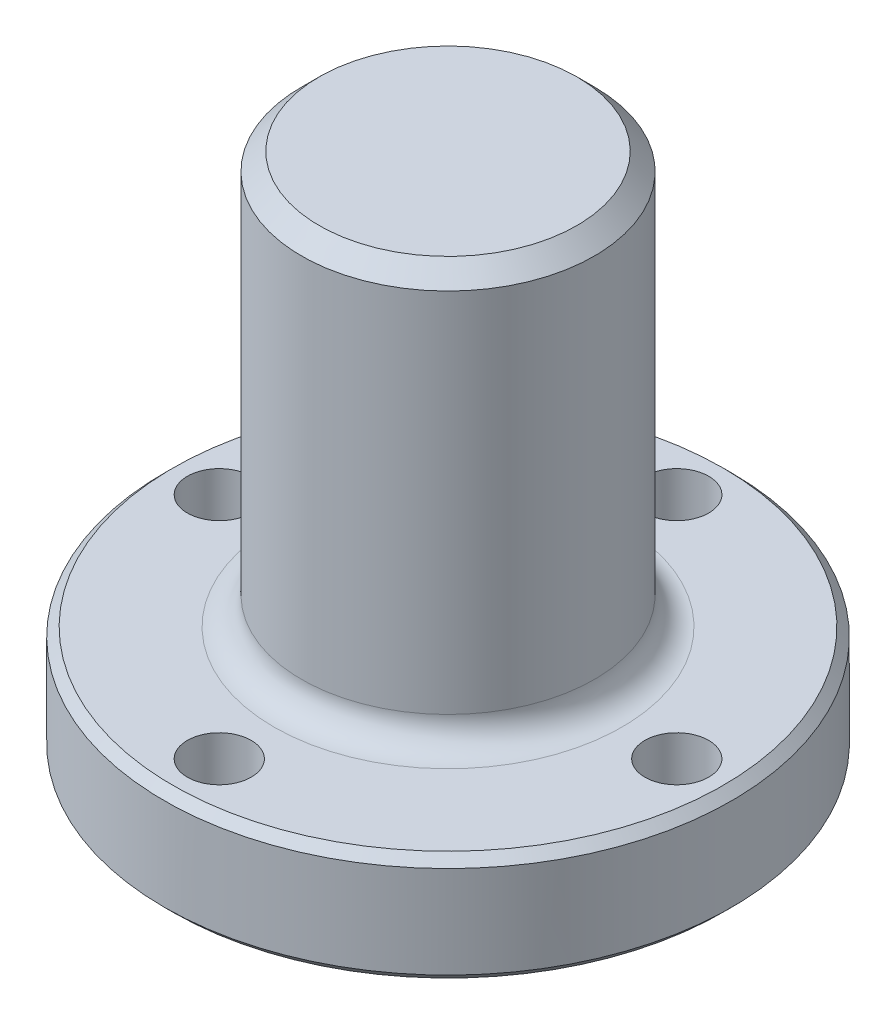
from build123d import *

# Parameters (mm, degrees)
CUT_EXTRUDE2_START = -20.2057
SKETCH2_R          = 2.7686
CUT_EXTRUDE2_DEPTH = 20.2057
CUT_EXTRUDE4_START = -20.2057
SKETCH3_R          = 2.7686
CUT_EXTRUDE4_DEPTH = 20.2057
FILLET1_R          = 2.3876
CHAMFER1_SIZE      = 0.762
CHAMFER2_SIZE      = 1.524


with BuildPart() as part:
    # Sketch1 → Revolve1 (revolve)
    with BuildSketch(Plane(origin=(0, 0, 0), x_dir=(0, 1, 0), z_dir=(0, 0, 1)), mode=Mode.PRIVATE) as revolve1_sk:
        Polygon((-25.0317, 0), (-25.0317, 8.7122), (-20.2057, 8.7122), (-20.2057, 24.6126), (-10.6807, 24.6126), (-10.6807, 12.7), (25.0317, 12.7), (25.0317, 0), align=None)
    revolve(revolve1_sk.sketch.rotate(Axis((0, -50.4317, 0), (0, 1, 0)), 270), axis=Axis((0, -50.4317, 0), (0, 1, 0)))

    # Sketch2 → Cut-Extrude2 (cut)
    with BuildSketch(Plane(origin=(0, 0, 0), x_dir=(-1, 0, 0), z_dir=(0, 1, 0)).offset(CUT_EXTRUDE2_START)):
        with Locations(Location((19.8374, 0, 0), (0, 0, 270))):
            Circle(SKETCH2_R)
    extrude(amount=CUT_EXTRUDE2_DEPTH, mode=Mode.SUBTRACT)

    # Sketch3 → Cut-Extrude4 (cut)
    with BuildSketch(Plane(origin=(0, 0, 0), x_dir=(-1, 0, 0), z_dir=(0, 1, 0)).offset(CUT_EXTRUDE4_START)):
        with Locations(Location((0, 19.8374, 0), (0, 0, 270))):
            Circle(SKETCH3_R)
        with Locations(Location((-19.8374, 0, 0), (0, 0, 270))):
            Circle(SKETCH3_R)
        with Locations(Location((0, -19.8374, 0), (0, 0, 270))):
            Circle(SKETCH3_R)
    extrude(amount=CUT_EXTRUDE4_DEPTH, mode=Mode.SUBTRACT)

    # Fillet1
    fillet1_edges = [part.edges().sort_by_distance(p)[0] for p in [
        (0, -10.6807, 12.7),
    ]]
    fillet(fillet1_edges, radius=FILLET1_R)

    # Chamfer1
    chamfer1_edges = [part.edges().sort_by_distance(p)[0] for p in [
        (0, -10.6807, 24.6126),
        (0, -20.2057, 24.6126),
    ]]
    chamfer(chamfer1_edges, length=CHAMFER1_SIZE)

    # Chamfer2
    chamfer2_edges = [part.edges().sort_by_distance(p)[0] for p in [
        (0, 25.0317, 12.7),
    ]]
    chamfer(chamfer2_edges, length=CHAMFER2_SIZE)


solid = part.part
